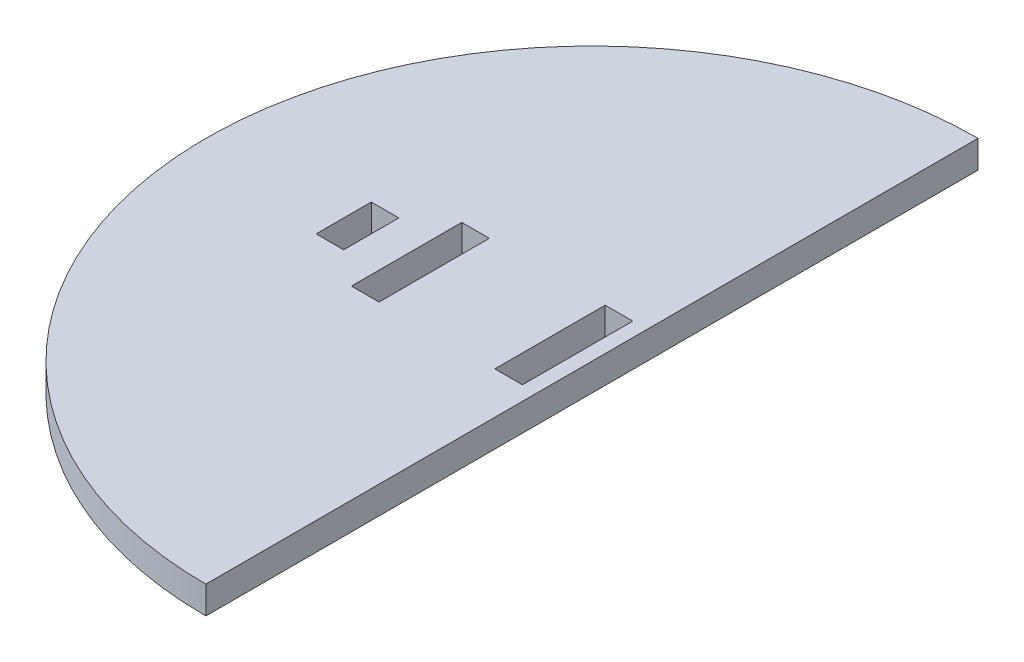
from build123d import *

# Parameters (mm, degrees)
SKETCH1_W           = 5
SKETCH1_H           = 10
BOSS_EXTRUDE1_DEPTH = 5
CUT_EXTRUDE1_DEPTH  = 10
CUT_EXTRUDE2_DEPTH  = 10


with BuildPart() as part:
    # Sketch1 → Boss-Extrude1 (new body)
    with BuildSketch(Plane(origin=(0, 0, 0), x_dir=(1, 0, 0), z_dir=(0, 1, 0))):
        with BuildLine():
            Line((0, 70), (0, -70))
            ThreePointArc((0, -70), (-70, 0), (0, 70))
        make_face()
        with Locations((-42.5, 0)):
            Rectangle(SKETCH1_W, SKETCH1_H, mode=Mode.SUBTRACT)
    extrude(amount=BOSS_EXTRUDE1_DEPTH)

    # Sketch2 → Cut-Extrude1 (cut)
    with BuildSketch(Plane(origin=(0, 5, 0), x_dir=(1, 0, 0), z_dir=(0, 1, 0))):
        Polygon((-7.6, -10), (-2.6, -10), (-2.6, 0), (-2.6, 10), (-7.6, 10), align=None)
    extrude(amount=-CUT_EXTRUDE1_DEPTH, mode=Mode.SUBTRACT)

    # Sketch3 → Cut-Extrude2 (cut)
    with BuildSketch(Plane(origin=(0, 5, 0), x_dir=(1, 0, 0), z_dir=(0, 1, 0))):
        Polygon((-28.6, 0), (-28.6, -10), (-33.6, -10), (-33.6, 10), (-28.6, 10), align=None)
    extrude(amount=-CUT_EXTRUDE2_DEPTH, mode=Mode.SUBTRACT)


solid = part.part
